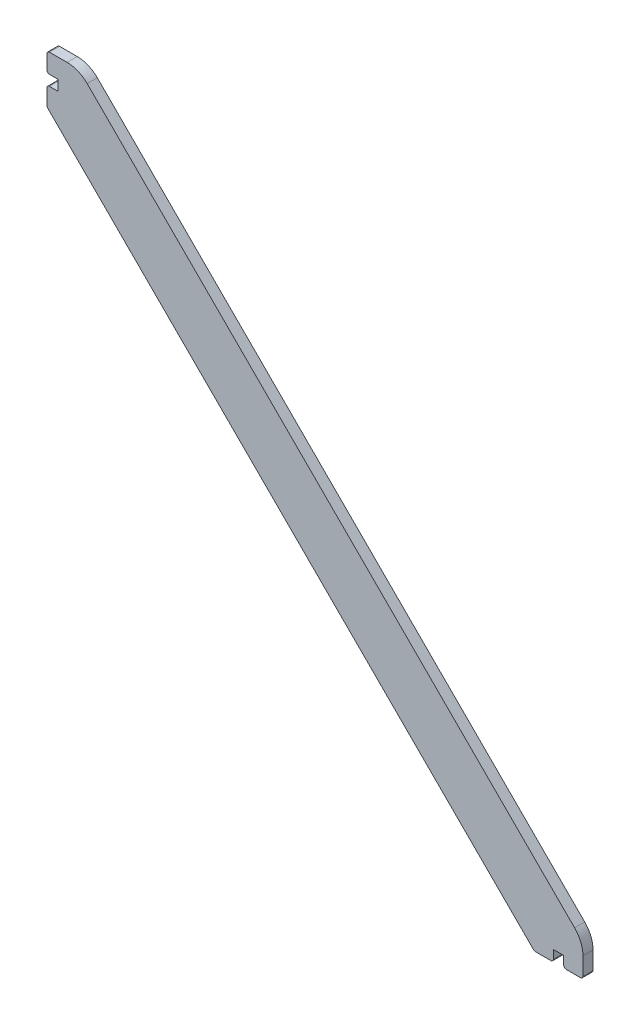
from build123d import *

# Parameters (mm, degrees)
BOSS_EXTRUDE1_DEPTH = 4


with BuildPart() as part:
    # Sketch1 → Boss-Extrude1 (new body)
    with BuildSketch(Plane.XY):
        with BuildLine():
            Line((-96.35, 107.6), (-103.304951288, 107.6))
            ThreePointArc((-103.304951288, 107.6), (-104.01205807, 107.307106781), (-104.304951288, 106.6))
            Line((-104.304951288, 106.6), (-104.304951288, 101))
            ThreePointArc((-104.304951288, 101), (-104.01205807, 100.292893219), (-103.304951288, 100))
            Line((-103.304951288, 100), (-100, 100))
            Line((-100, 100), (-100, 95.9))
            Line((-100, 95.9), (-103.304951288, 95.9))
            ThreePointArc((-103.304951288, 95.9), (-104.01205807, 95.607106781), (-104.304951288, 94.9))
            Line((-104.304951288, 94.9), (-104.304951288, 88.809262274))
            ThreePointArc((-104.304951288, 88.809262274), (-104.228830821, 88.426578842), (-104.01205807, 88.102155493))
            Line((-104.01205807, 88.102155493), (-100, 84.090097423))
            Line((-100, 84.090097423), (84.090097423, -100))
            Line((84.090097423, -100), (88.102155493, -104.01205807))
            ThreePointArc((88.102155493, -104.01205807), (88.426578842, -104.228830821), (88.809262274, -104.304951288))
            Line((88.809262274, -104.304951288), (94.9, -104.304951288))
            ThreePointArc((94.9, -104.304951288), (95.607106781, -104.01205807), (95.9, -103.304951288))
            Line((95.9, -103.304951288), (95.9, -100))
            Line((95.9, -100), (100, -100))
            Line((100, -100), (100, -103.304951288))
            ThreePointArc((100, -103.304951288), (100.292893219, -104.01205807), (101, -104.304951288))
            Line((101, -104.304951288), (106.6, -104.304951288))
            ThreePointArc((106.6, -104.304951288), (107.307106781, -104.01205807), (107.6, -103.304951288))
            Line((107.6, -103.304951288), (107.6, -96.35))
            ThreePointArc((107.6, -96.35), (106.743644741, -92.044811386), (104.304951288, -88.395048712))
            Line((104.304951288, -88.395048712), (100, -84.090097423))
            Line((100, -84.090097423), (-84.090097423, 100))
            Line((-84.090097423, 100), (-88.395048712, 104.304951288))
            ThreePointArc((-88.395048712, 104.304951288), (-92.044811386, 106.743644741), (-96.35, 107.6))
        make_face()
    extrude(amount=BOSS_EXTRUDE1_DEPTH)


solid = part.part
